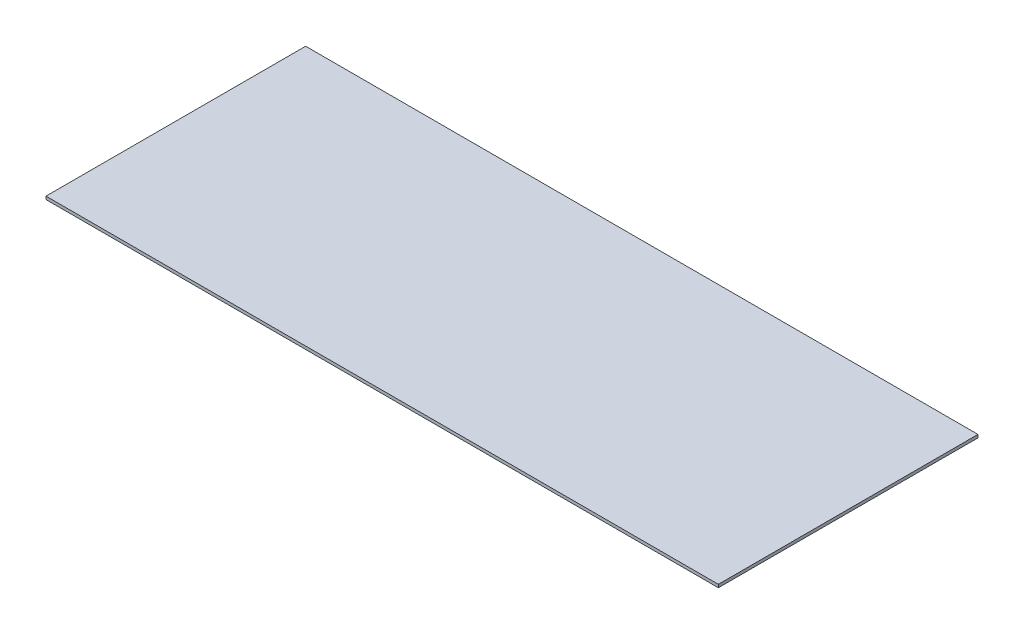
from build123d import *

# Parameters (mm, degrees)
SKETCH1_W           = 448
SKETCH1_H           = 173
BOSS_EXTRUDE1_DEPTH = 2


with BuildPart() as part:
    # Sketch1 → Boss-Extrude1 (new body)
    with BuildSketch(Plane(origin=(0, 0, 0), x_dir=(1, 0, 0), z_dir=(0, 1, 0))):
        with Locations((224, 86.5)):
            Rectangle(SKETCH1_W, SKETCH1_H)
    extrude(amount=BOSS_EXTRUDE1_DEPTH)


solid = part.part
